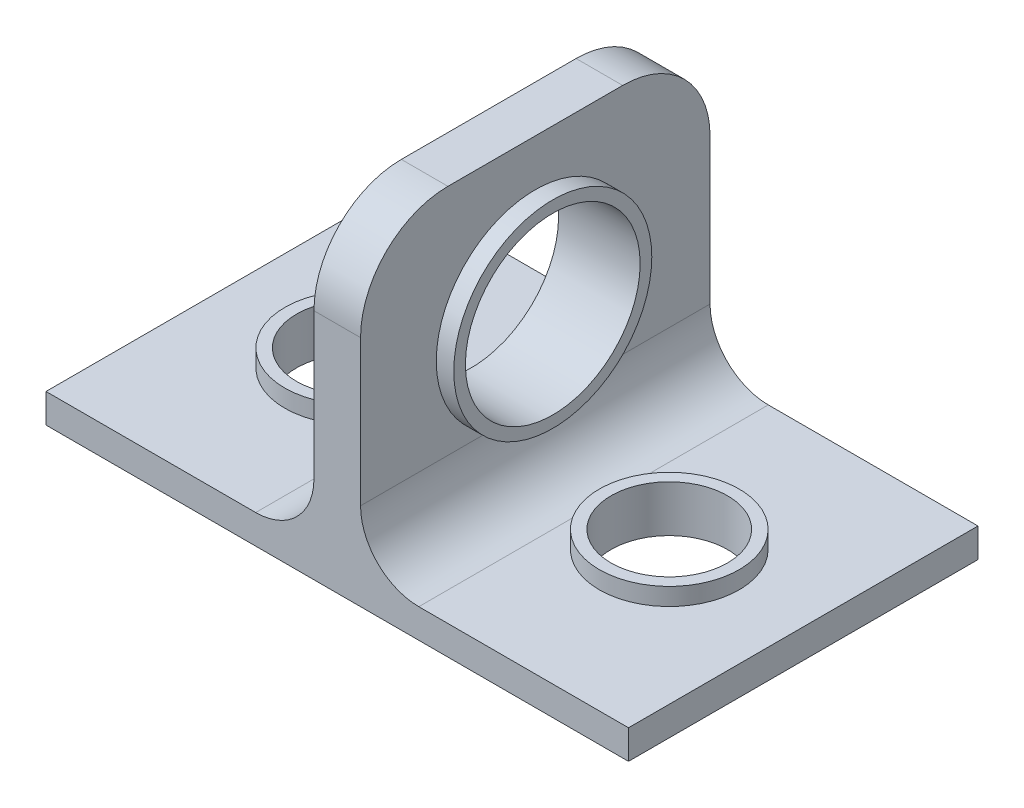
from build123d import *
from build123d.topology import SkipClean

# Parameters (mm, degrees)
BOSS_EXTRUDE1_DEPTH      = 30
BOSS_EXTRUDE1_DEPTH_BACK = 30
SKETCH2_R                = 10
CUT_EXTRUDE1_DEPTH       = 5
BOSS_EXTRUDE2_START      = 3
SKETCH2_3_R              = 12
SKETCH2_3_R_2            = 10
BOSS_EXTRUDE2_DEPTH      = 3
SKETCH3_R                = 15
CUT_EXTRUDE2_DEPTH       = 8
BOSS_EXTRUDE3_START      = 3
SKETCH3_3_R              = 17
SKETCH3_3_R_2            = 15
BOSS_EXTRUDE3_DEPTH      = 3
FILLET1_R                = 15


with BuildPart() as part:
    # Sketch1 → Boss-Extrude1 (new, two sides: drawn at the far end of the back side and taken through both)
    with BuildSketch(Plane.XY.offset(-BOSS_EXTRUDE1_DEPTH_BACK)):
        with BuildLine():
            Line((50, 0), (-50, 0))
            Line((-50, 0), (-50, 5))
            Line((-50, 5), (-14, 5))
            ThreePointArc((-14, 5), (-6.928932188, 7.928932188), (-4, 15))
            Line((-4, 15), (-4, 55))
            Line((-4, 55), (4, 55))
            Line((4, 55), (4, 15))
            ThreePointArc((4, 15), (6.928932188, 7.928932188), (14, 5))
            Line((14, 5), (50, 5))
            Line((50, 5), (50, 0))
        make_face()
    extrude(amount=BOSS_EXTRUDE1_DEPTH + BOSS_EXTRUDE1_DEPTH_BACK)

    # Sketch2 → Cut-Extrude1 (cut)
    with BuildSketch(Plane(origin=(0, 5, 0), x_dir=(1, 0, 0), z_dir=(0, 1, 0))):
        with Locations(Location((-27, 0, 0), (0, 0, 270))):
            Circle(SKETCH2_R)
    cut_extrude1 = extrude(amount=-CUT_EXTRUDE1_DEPTH, mode=Mode.SUBTRACT)

    # Sketch2<3> → Boss-Extrude2 (add)
    with BuildSketch(Plane(origin=(0, 5, 0), x_dir=(1, 0, 0), z_dir=(0, 1, 0)).offset(BOSS_EXTRUDE2_START)):
        with Locations(Location((-27, 0, 0), (0, 0, 270))):
            Circle(SKETCH2_3_R)
        with Locations(Location((-27, 0, 0), (0, 0, 270))):
            Circle(SKETCH2_3_R_2, mode=Mode.SUBTRACT)
    boss_extrude2 = extrude(amount=-BOSS_EXTRUDE2_DEPTH)

    # Mirror1: Cut-Extrude1, Boss-Extrude2 across plane
    add(cut_extrude1.mirror(Plane(origin=(0, 0, 0), x_dir=(0, 0, 1), z_dir=(1, 0, 0))), mode=Mode.SUBTRACT)
    add(boss_extrude2.mirror(Plane(origin=(0, 0, 0), x_dir=(0, 0, 1), z_dir=(1, 0, 0))))

    # Sketch3 → Cut-Extrude2 (cut)
    with BuildSketch(Plane.ZY.offset(4)):
        with Locations(Location((0, 30, 0), (0, 0, 270))):
            Circle(SKETCH3_R)
    extrude(amount=-CUT_EXTRUDE2_DEPTH, mode=Mode.SUBTRACT)

    # Sketch3<3> → Boss-Extrude3 (add)
    with BuildSketch(Plane.ZY.offset(4).offset(BOSS_EXTRUDE3_START)):
        with Locations(Location((0, 30, 0), (0, 0, 241.927513064))):
            Circle(SKETCH3_3_R)
        with Locations((0, 30)):
            Circle(SKETCH3_3_R_2, mode=Mode.SUBTRACT)
    boss_extrude3 = extrude(amount=-BOSS_EXTRUDE3_DEPTH)

    # Mirror2: Boss-Extrude3 across plane
    with SkipClean():  # the faces are left unmerged after this step: merging them gives an invalid solid
        add(boss_extrude3.mirror(Plane(origin=(0, 0, 0), x_dir=(0, 0, 1), z_dir=(1, 0, 0))))

    # Fillet1
    fillet1_edges = [part.edges().sort_by_distance(p)[0] for p in [
        (0, 55, -30),
        (0, 55, 30),
    ]]
    fillet(fillet1_edges, radius=FILLET1_R)


solid = part.part
